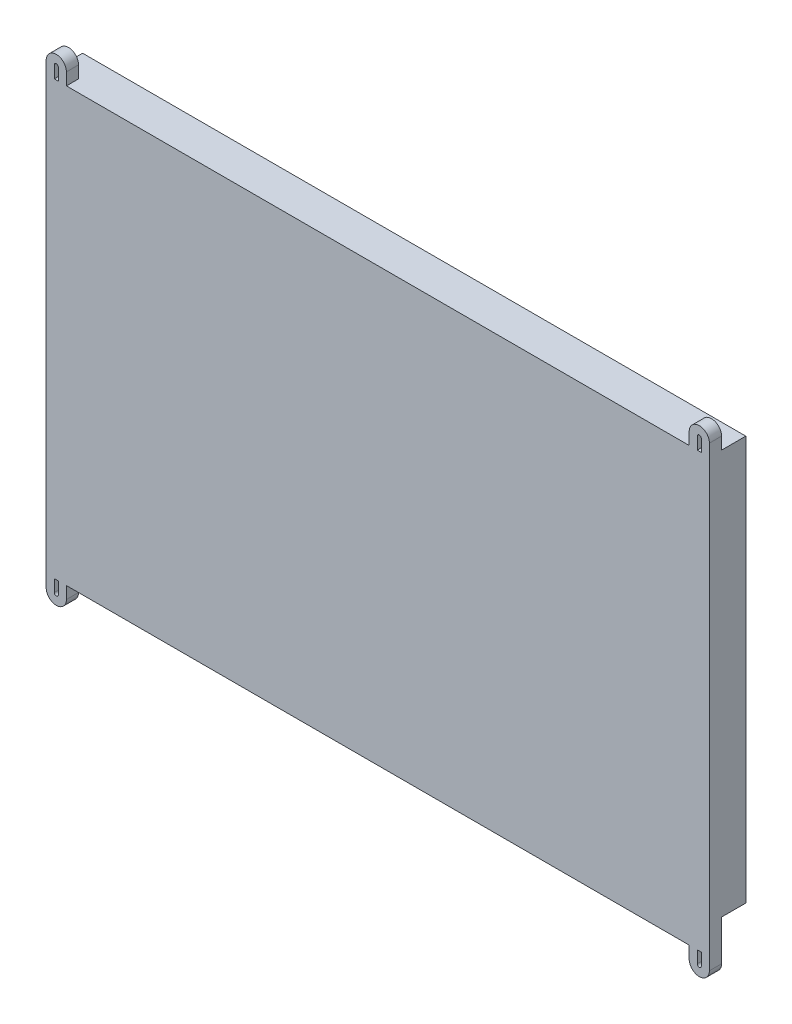
from build123d import *

# Parameters (mm, degrees)
ESBO_O1_W                = 164
ESBO_O1_H                = 107
RESSALTO_EXTRUS_O1_DEPTH = 4.5
EXTRUS_O_FINA2_DEPTH     = 3
ESBO_O3_W                = 164
ESBO_O3_H                = 7
CORTE_EXTRUS_O1_DEPTH    = 6
ESBO_O5_W                = 153.790549152
ESBO_O5_H                = 89.226156431
CORTE_EXTRUS_O2_DEPTH    = 1


with BuildPart() as part:
    # Esboço1 → Ressalto-extrusão1 (new, symmetric)
    with BuildSketch(Plane.XY):
        with Locations((-7.64158605, 1.401746725)):
            Rectangle(ESBO_O1_W, ESBO_O1_H)
    extrude(amount=RESSALTO_EXTRUS_O1_DEPTH, both=True)

    # Esboço2 → Extrusão-Fina2 (add)
    with BuildSketch(Plane.XY.offset(4.5)):
        with BuildLine():
            Line((-89.64158605, 54.901746725), (-89.64158605, 57.901746725))
            ThreePointArc((-89.64158605, 57.901746725), (-87.14158605, 60.401746725), (-84.64158605, 57.901746725))
            Line((-84.64158605, 57.901746725), (-84.64158605, 54.901746725))
            Line((-84.64158605, 54.901746725), (-86.64158605, 54.901746725))
            Line((-86.64158605, 54.901746725), (-86.64158605, 57.901746725))
            ThreePointArc((-86.64158605, 57.901746725), (-87.14158605, 58.401746725), (-87.64158605, 57.901746725))
            Line((-87.64158605, 57.901746725), (-87.64158605, 54.901746725))
            Line((-87.64158605, 54.901746725), (-89.64158605, 54.901746725))
        make_face()
        with BuildLine():
            Line((69.35841395, 54.901746725), (69.35841395, 57.901746725))
            ThreePointArc((69.35841395, 57.901746725), (71.85841395, 60.401746725), (74.35841395, 57.901746725))
            Line((74.35841395, 57.901746725), (74.35841395, 54.901746725))
            Line((74.35841395, 54.901746725), (72.35841395, 54.901746725))
            Line((72.35841395, 54.901746725), (72.35841395, 57.901746725))
            ThreePointArc((72.35841395, 57.901746725), (71.85841395, 58.401746725), (71.35841395, 57.901746725))
            Line((71.35841395, 57.901746725), (71.35841395, 54.901746725))
            Line((71.35841395, 54.901746725), (69.35841395, 54.901746725))
        make_face()
        with BuildLine():
            Line((-84.64158605, -52.098253275), (-84.64158605, -55.098253275))
            ThreePointArc((-84.64158605, -55.098253275), (-87.14158605, -57.598253275), (-89.64158605, -55.098253275))
            Line((-89.64158605, -55.098253275), (-89.64158605, -52.098253275))
            Line((-89.64158605, -52.098253275), (-87.64158605, -52.098253275))
            Line((-87.64158605, -52.098253275), (-87.64158605, -55.098253275))
            ThreePointArc((-87.64158605, -55.098253275), (-87.14158605, -55.598253275), (-86.64158605, -55.098253275))
            Line((-86.64158605, -55.098253275), (-86.64158605, -52.098253275))
            Line((-86.64158605, -52.098253275), (-84.64158605, -52.098253275))
        make_face()
        with BuildLine():
            Line((74.35841395, -52.098253275), (74.35841395, -55.098253275))
            ThreePointArc((74.35841395, -55.098253275), (71.85841395, -57.598253275), (69.35841395, -55.098253275))
            Line((69.35841395, -55.098253275), (69.35841395, -52.098253275))
            Line((69.35841395, -52.098253275), (71.35841395, -52.098253275))
            Line((71.35841395, -52.098253275), (71.35841395, -55.098253275))
            ThreePointArc((71.35841395, -55.098253275), (71.85841395, -55.598253275), (72.35841395, -55.098253275))
            Line((72.35841395, -55.098253275), (72.35841395, -52.098253275))
            Line((72.35841395, -52.098253275), (74.35841395, -52.098253275))
        make_face()
    extrude(amount=-EXTRUS_O_FINA2_DEPTH)

    # Esboço3 → Corte-extrusão1 (cut)
    with BuildSketch(Plane(origin=(0, 0, -4.5), x_dir=(-1, 0, 0), z_dir=(0, 0, -1))):
        with Locations((7.64158605, -48.598253275)):
            Rectangle(ESBO_O3_W, ESBO_O3_H)
    extrude(amount=-CORTE_EXTRUS_O1_DEPTH, mode=Mode.SUBTRACT)

    # Esboço5 → Corte-extrusão2 (cut)
    with BuildSketch(Plane(origin=(0, 0, -4.5), x_dir=(-1, 0, 0), z_dir=(0, 0, -1))):
        with Locations((6.536860626, 7.288668509)):
            Rectangle(ESBO_O5_W, ESBO_O5_H)
    extrude(amount=-CORTE_EXTRUS_O2_DEPTH, mode=Mode.SUBTRACT)


solid = part.part
